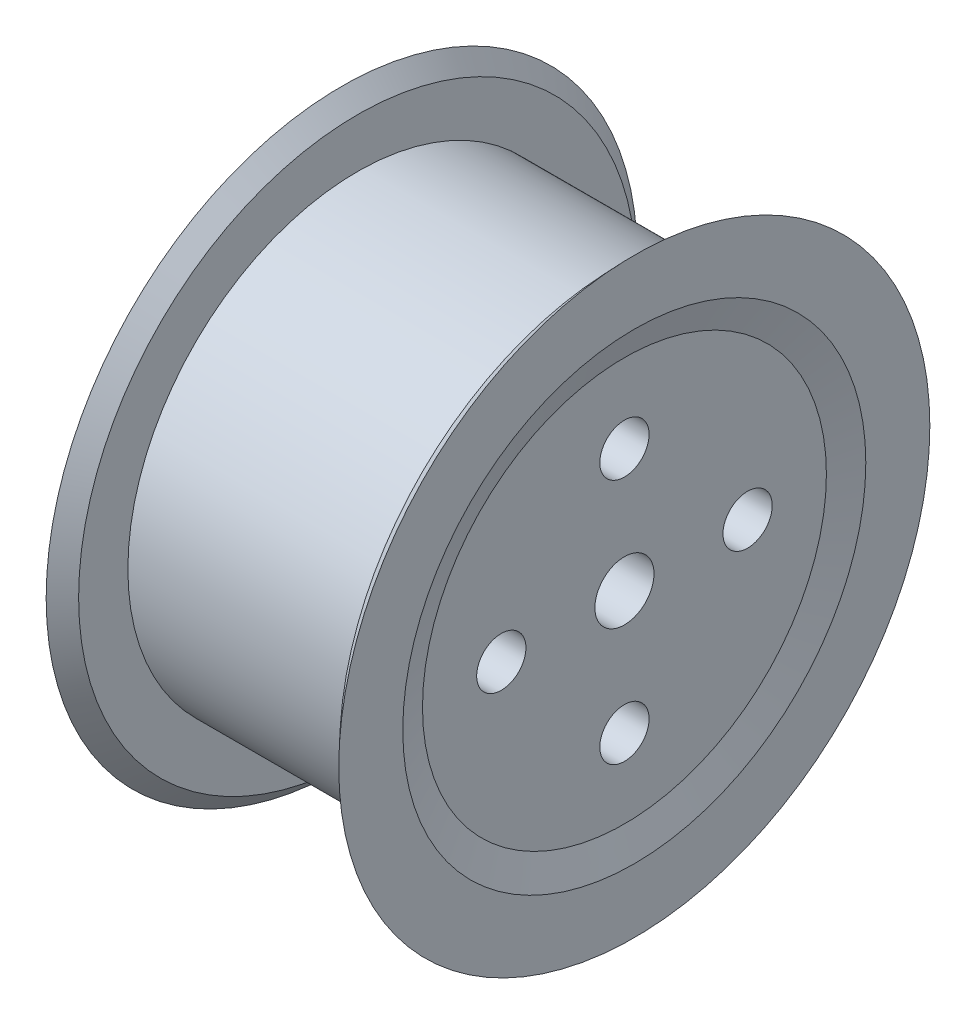
from build123d import *

# Parameters (mm, degrees)
SKETCH1_W                   = 7.8
SKETCH1_H                   = 17.45
SKETCH2_R                   = 2.5
CUT_EXTRUDE1_DEPTH          = 57.623758265
M6_TAPPED_HOLE2_D           = 5
M6_TAPPED_HOLE2_DEPTH       = 55
M6_TAPPED_HOLE2_CSINK_D     = 6.05
M6_TAPPED_HOLE2_CSINK_ANGLE = 90
M6_TAPPED_HOLE2_TIP         = 1.502151548
SKETCH5_R                   = 3
CUT_EXTRUDE2_DEPTH          = 56.966507842


with BuildPart() as part:
    # Sketch1 → Revolve1 (revolve)
    with BuildSketch(Plane.XY, mode=Mode.PRIVATE) as revolve1_sk:
        Polygon((28.1, 23.305), (1.6, 23.305), (0.065, 23.305), (1, 20.5), (1, 17.45), (0, 17.45), (0, 0), (28.7, 0), (28.7, 20.5), (29.7, 23.5), (29.7, 30), (28.1, 28.305), align=None)
        Polygon((0.065, 23.305), (1.6, 23.305), (1.6, 28.305), (0, 30), (0, 23.5), align=None)
        with Locations((-3.9, 8.725)):
            Rectangle(SKETCH1_W, SKETCH1_H)
    revolve(revolve1_sk.sketch.rotate(Axis((0, 0, 0), (1, 0, 0)), 90), axis=Axis((0, 0, 0), (1, 0, 0)))

    # Sketch2 → Cut-Extrude1 (cut, through all)
    with BuildSketch(Plane(origin=(29.7, 0, 0), x_dir=(0, 0, -1), z_dir=(1, 0, 0))):
        with Locations((12.5, 0)):
            Circle(SKETCH2_R)
        with Locations((0, -12.5)):
            Circle(SKETCH2_R)
        with Locations((-12.5, 0)):
            Circle(SKETCH2_R)
        with Locations((0, 12.5)):
            Circle(SKETCH2_R)
    extrude(amount=-CUT_EXTRUDE1_DEPTH, mode=Mode.SUBTRACT)

    # M6 Tapped Hole2
    with Locations(Plane(origin=(-7.8, 0, -12.5), x_dir=(0, 0, -1), z_dir=(-1, 0, 0))):
        with Locations((0, 0), (-12.5, -12.5), (-25, 0), (-12.5, 12.5)):
            CounterSinkHole(M6_TAPPED_HOLE2_D / 2, M6_TAPPED_HOLE2_CSINK_D / 2, depth=M6_TAPPED_HOLE2_DEPTH, counter_sink_angle=M6_TAPPED_HOLE2_CSINK_ANGLE)
            with Locations((0, 0, -(M6_TAPPED_HOLE2_DEPTH + M6_TAPPED_HOLE2_TIP / 2))):  # 118° drill point
                Cone(0, M6_TAPPED_HOLE2_D / 2, M6_TAPPED_HOLE2_TIP, mode=Mode.SUBTRACT)

    # Sketch5 → Cut-Extrude2 (cut, through all)
    with BuildSketch(Plane(origin=(28.7, 0, 0), x_dir=(0, 0, -1), z_dir=(1, 0, 0))):
        Circle(SKETCH5_R)
    extrude(amount=-CUT_EXTRUDE2_DEPTH, mode=Mode.SUBTRACT)


solid = part.part
